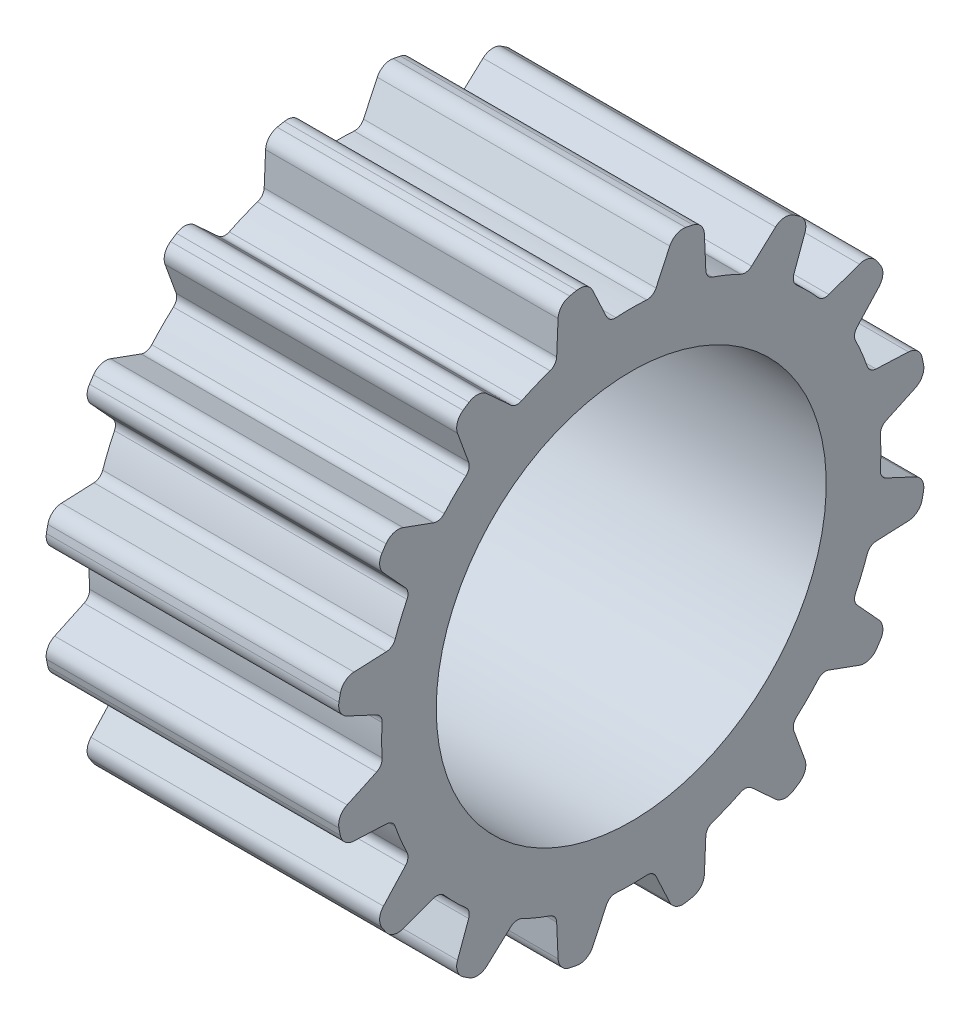
from build123d import *

# Parameters (mm, degrees)
SKETCH2_W         = 6
SKETCH2_H         = 6.1
COG_DEPTH         = 11.50809212
PATTERN_COG_COUNT = 16
SKETCH8_W         = 17.303989153
SKETCH8_H         = 4


with BuildPart() as part:
    # Sketch2 → Body (revolve)
    with BuildSketch(Plane.XY, mode=Mode.PRIVATE) as body_sk:
        with Locations((3, 3.05)):
            Rectangle(SKETCH2_W, SKETCH2_H)
    revolve(body_sk.sketch.rotate(Axis((0, 0, 0), (1, 0, 0)), 90), axis=Axis((0, 0, 0), (1, 0, 0)))

    # Sketch6 → Cog (cut, through all)
    with BuildSketch(Plane(origin=(0, 0, 0), x_dir=(0, 0, -1), z_dir=(1, 0, 0))):
        with BuildLine():
            Line((0.789835397, 5.82877936), (0.508392514, 5.225223151))
            ThreePointArc((0.508392514, 5.225223151), (0.429351309, 5.137842761), (0.314832372, 5.1101253))
            ThreePointArc((0.314832372, 5.1101253), (0, 5.11981445), (-0.314832372, 5.1101253))
            ThreePointArc((-0.314832372, 5.1101253), (-0.429351309, 5.137842761), (-0.508392514, 5.225223151))
            Line((-0.508392514, 5.225223151), (-0.789835397, 5.82877936))
            ThreePointArc((-0.789835397, 5.82877936), (-0.924476923, 5.968756351), (-1.116644684, 5.996924599))
            ThreePointArc((-1.116644684, 5.996924599), (0, 6.1), (1.116644684, 5.996924599))
            ThreePointArc((1.116644684, 5.996924599), (0.924476923, 5.968756351), (0.789835397, 5.82877936))
        make_face()
    cog = extrude(amount=COG_DEPTH, mode=Mode.SUBTRACT)

    # Pattern-Cog: Cog ×16 about axis
    pattern_cog_axis = Axis((0, 0, 0), (1, 0, 0))
    for i in range(1, PATTERN_COG_COUNT):
        add(cog.rotate(pattern_cog_axis, i * 360 / PATTERN_COG_COUNT), mode=Mode.SUBTRACT)

    # Sketch8 → Hole-Shaft (revolve, cut)
    with BuildSketch(Plane.XY, mode=Mode.PRIVATE) as hole_shaft_sk:
        with Locations((7.348005424, -2)):
            Rectangle(SKETCH8_W, SKETCH8_H)
    revolve(hole_shaft_sk.sketch.rotate(Axis((-1.303989153, 0, 0), (1, 0, 0)), 270), axis=Axis((-1.303989153, 0, 0), (1, 0, 0)), mode=Mode.SUBTRACT)


solid = part.part
